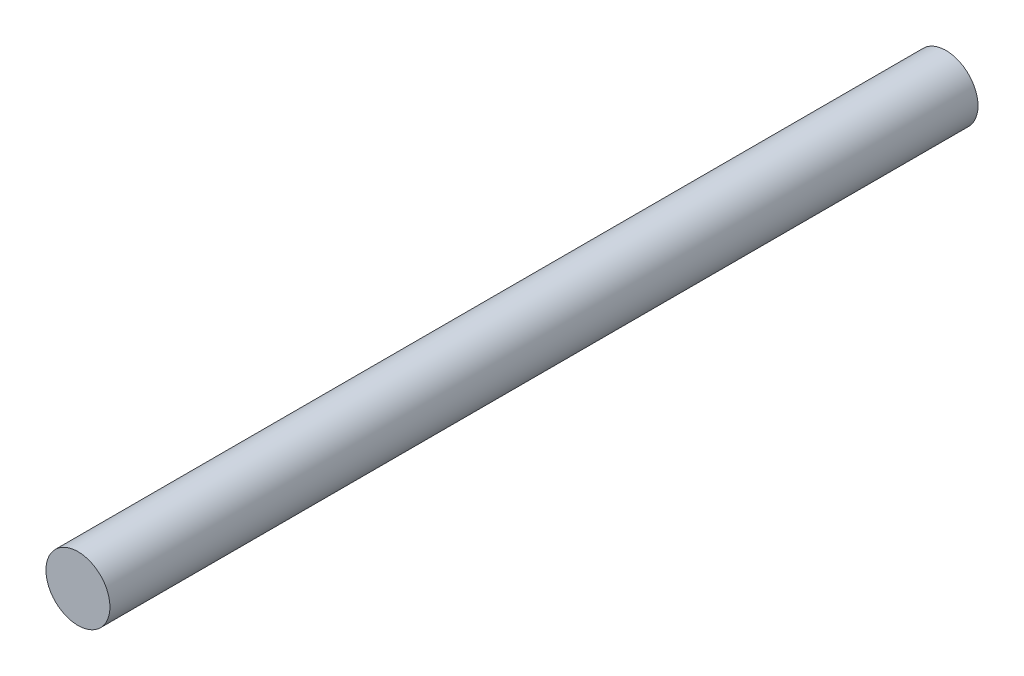
from build123d import *

# Parameters (mm, degrees)
SKETCH1_R           = 4
BOSS_EXTRUDE1_DEPTH = 108.5


with BuildPart() as part:
    # Sketch1 → Boss-Extrude1 (new body)
    with BuildSketch(Plane.XY):
        Circle(SKETCH1_R)
    extrude(amount=BOSS_EXTRUDE1_DEPTH)


solid = part.part
